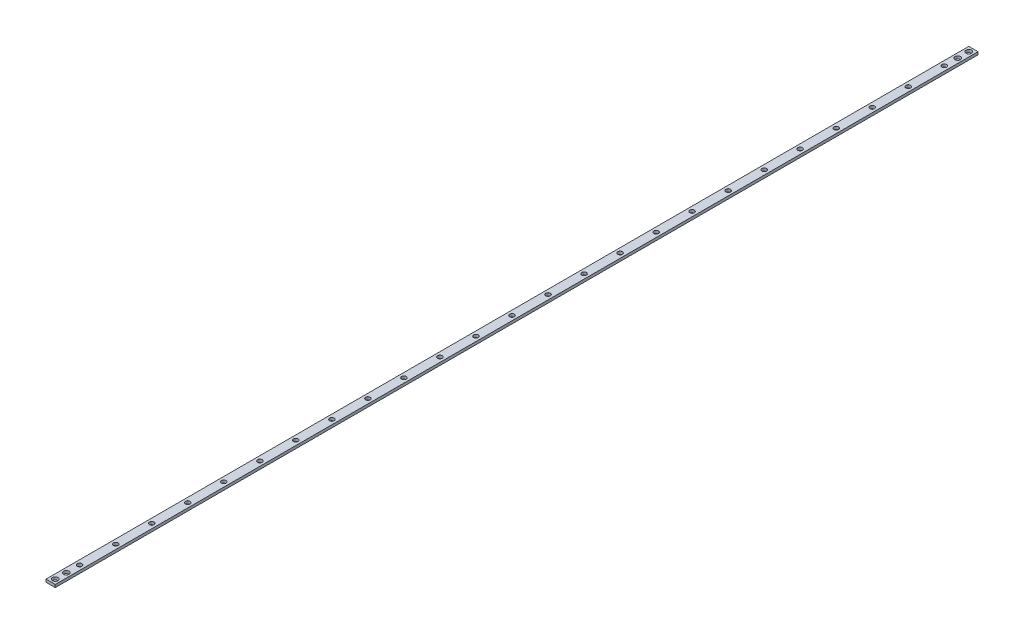
from build123d import *

# Parameters (mm, degrees)
SKETCH1_W                       = 10
SKETCH1_H                       = 1000
BOSS_EXTRUDE1_DEPTH             = 3
LPATTERN2_COUNT                 = 2
LPATTERN2_PITCH                 = 12
LPATTERN3_COUNT                 = 2
LPATTERN3_PITCH                 = 12
F_5_0MM_DOWEL_HOLE1_D           = 5
F_5_0MM_DOWEL_HOLE1_CSINK_D     = 5.05
F_5_0MM_DOWEL_HOLE1_CSINK_ANGLE = 90
LPATTERN1_COUNT                 = 25
LPATTERN1_PITCH                 = 39.041666667


with BuildPart() as part:
    # Sketch1 → Boss-Extrude1 (new body)
    with BuildSketch(Plane(origin=(0, 0, 0), x_dir=(1, 0, 0), z_dir=(0, 1, 0))):
        with Locations((5, 500)):
            Rectangle(SKETCH1_W, SKETCH1_H)
    extrude(amount=BOSS_EXTRUDE1_DEPTH)

    # Sketch13 → Tap Drill for M7x1.0 Tap1 (revolve, cut)
    with BuildSketch(Plane(origin=(5, 0, -5), x_dir=(0, 0, -1), z_dir=(1, 0, 0))):
        Polygon((0, 0), (0, 3), (3, 3), (3, 0.025), (3.025, 0), align=None)
    tap_drill_for_m7x1_0_tap1 = revolve(axis=Axis((5, -6.35, -5), (0, 1, 0)), mode=Mode.SUBTRACT)

    # LPattern2: Tap Drill for M7x1.0 Tap1 ×2
    with Locations(*[(0, 0, -i * LPATTERN2_PITCH) for i in range(1, LPATTERN2_COUNT)]):
        add(tap_drill_for_m7x1_0_tap1, mode=Mode.SUBTRACT)

    # Sketch15 → Tap Drill for M7x1.0 Tap2 (revolve, cut)
    with BuildSketch(Plane(origin=(5, 0, -995), x_dir=(0, 0, -1), z_dir=(1, 0, 0))):
        Polygon((0, 0), (0, 3), (3, 3), (3, 0.025), (3.025, 0), align=None)
    tap_drill_for_m7x1_0_tap2 = revolve(axis=Axis((5, -6.35, -995), (0, 1, 0)), mode=Mode.SUBTRACT)

    # LPattern3: Tap Drill for M7x1.0 Tap2 ×2
    with Locations(*[(0, 0, i * LPATTERN3_PITCH) for i in range(1, LPATTERN3_COUNT)]):
        add(tap_drill_for_m7x1_0_tap2, mode=Mode.SUBTRACT)

    # Ø5.0mm Dowel Hole1 (through all)
    with Locations(Plane(origin=(0, 3, 0), x_dir=(1, 0, 0), z_dir=(0, 1, 0))):
        with Locations((5, 31.5)):
            f_5_0mm_dowel_hole1 = CounterSinkHole(F_5_0MM_DOWEL_HOLE1_D / 2, F_5_0MM_DOWEL_HOLE1_CSINK_D / 2, counter_sink_angle=F_5_0MM_DOWEL_HOLE1_CSINK_ANGLE)

    # LPattern1: Ø5.0mm Dowel Hole1 ×25
    with Locations(*[(0, 0, -i * LPATTERN1_PITCH) for i in range(1, LPATTERN1_COUNT)]):
        add(f_5_0mm_dowel_hole1, mode=Mode.SUBTRACT)


solid = part.part
